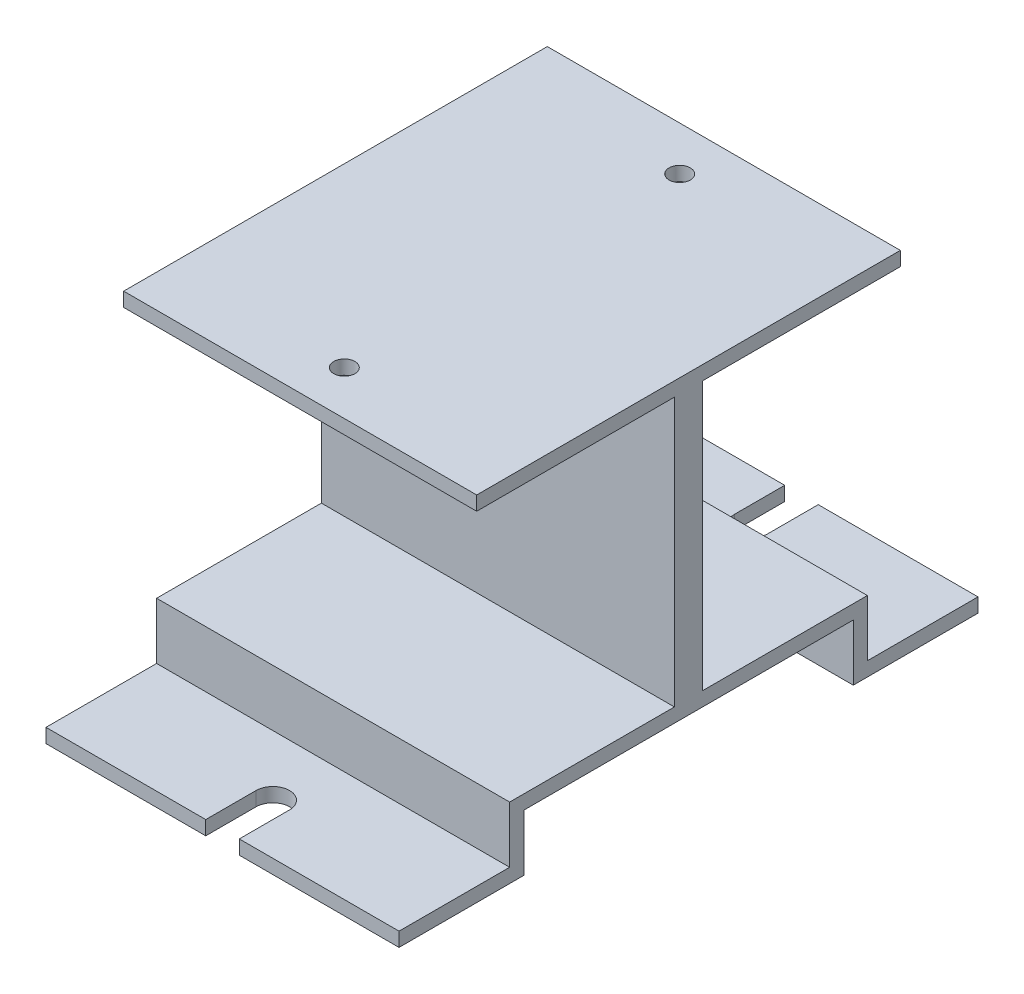
from build123d import *

# Parameters (mm, degrees)
EXTRUDE_THIN1_DEPTH = 25
EXTRUDE_THIN2_DEPTH = 25
CUT_EXTRUDE1_DEPTH  = 10
SKETCH4_R           = 1.5
CUT_EXTRUDE2_DEPTH  = 3


with BuildPart() as part:
    # Sketch1 → Extrude-Thin1 (new, symmetric)
    with BuildSketch(Plane(origin=(0, 0, 0), x_dir=(0, 0, -1), z_dir=(1, 0, 0))):
        Polygon((0, 0), (23.333492345, 0), (23.333492345, -8), (41, -8), (41, -6), (25.333492345, -6), (25.333492345, 2), (0, 2), align=None)
    extrude(amount=EXTRUDE_THIN1_DEPTH, both=True)

    # Sketch2 → Extrude-Thin2 (add, symmetric)
    with BuildSketch(Plane(origin=(0, 0, 0), x_dir=(0, 0, -1), z_dir=(1, 0, 0))):
        Polygon((0, 0), (0, 42), (30, 42), (30, 40), (2, 40), (2, 0), align=None)
    extrude(amount=EXTRUDE_THIN2_DEPTH, both=True)

    # Mirror1: part across face


with BuildPart() as part_1:
    add(part.part)
    add(part.part.mirror(Plane(origin=(0, 21, 0), x_dir=(1, 0, 0), z_dir=(0, 0, 1))))

    # Sketch3 → Cut-Extrude1 (cut)
    with BuildSketch(Plane(origin=(0, -6, 0), x_dir=(1, 0, 0), z_dir=(0, 1, 0))):
        with BuildLine():
            Line((-2.375, 33.875), (-2.375, 51.560435524))
            ThreePointArc((-2.375, 51.560435524), (0, 53.935435524), (2.375, 51.560435524))
            Line((2.375, 51.560435524), (2.375, 33.875))
            ThreePointArc((2.375, 33.875), (0, 31.5), (-2.375, 33.875))
        make_face()
        with BuildLine():
            Line((-2.375, -33.875), (-2.375, -51.560435524))
            ThreePointArc((-2.375, -51.560435524), (0, -53.935435524), (2.375, -51.560435524))
            Line((2.375, -51.560435524), (2.375, -33.875))
            ThreePointArc((2.375, -33.875), (0, -31.5), (-2.375, -33.875))
        make_face()
    extrude(amount=-CUT_EXTRUDE1_DEPTH, mode=Mode.SUBTRACT)

    # Sketch4 → Cut-Extrude2 (cut)
    with BuildSketch(Plane(origin=(0, 42, 0), x_dir=(1, 0, 0), z_dir=(0, 1, 0))):
        with Locations(Location((0, 23.75, 0), (0, 0, 270))):
            Circle(SKETCH4_R)
        with Locations(Location((0, -23.75, 0), (0, 0, 270))):
            Circle(SKETCH4_R)
    extrude(amount=-CUT_EXTRUDE2_DEPTH, mode=Mode.SUBTRACT)


solid = part_1.part
